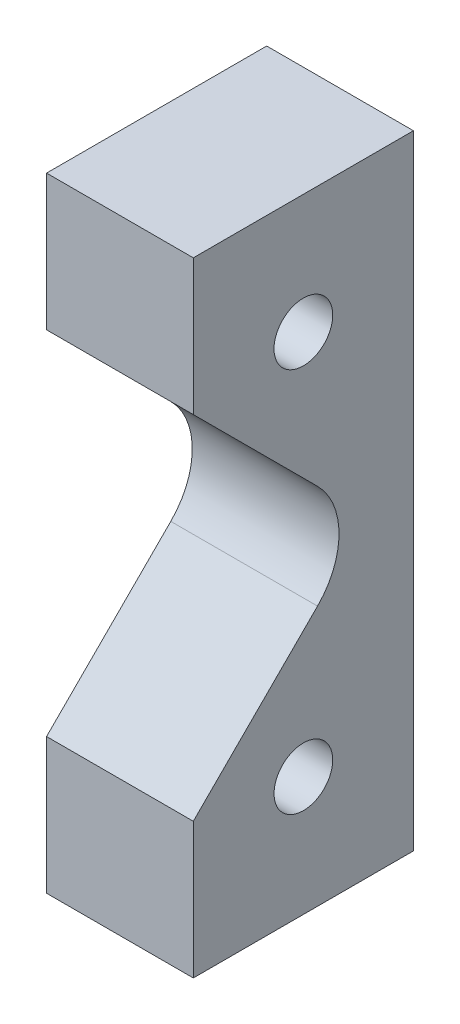
from build123d import *

# Parameters (mm, degrees)
EXTRUDE_1_DEPTH     = 20
SKETCH_3_R          = 4
CUT_EXTRUDE_1_DEPTH = 20


with BuildPart() as part:
    # 草图1 → 凸台-拉伸1 (new body)
    with BuildSketch(Plane(origin=(0, 0, 0), x_dir=(0, 0, -1), z_dir=(1, 0, 0))):
        with BuildLine():
            Line((-15, 24), (1.928932188, 7.071067812))
            ThreePointArc((1.928932188, 7.071067812), (4.857864376, 0), (1.928932188, -7.071067812))
            Line((1.928932188, -7.071067812), (-15, -24))
            Line((-15, -24), (-15, -42.5))
            Line((-15, -42.5), (15, -42.5))
            Line((15, -42.5), (15, 42.5))
            Line((15, 42.5), (-15, 42.5))
            Line((-15, 42.5), (-15, 24))
        make_face()
    extrude(amount=EXTRUDE_1_DEPTH)

    # 草图3 → 切除-拉伸1 (cut)
    with BuildSketch(Plane.ZY):
        with Locations((0, 26.25)):
            Circle(SKETCH_3_R)
        with Locations(Location((0, -26.25, 0), (0, 0, 180))):
            Circle(SKETCH_3_R)
    extrude(amount=-CUT_EXTRUDE_1_DEPTH, mode=Mode.SUBTRACT)


solid = part.part
